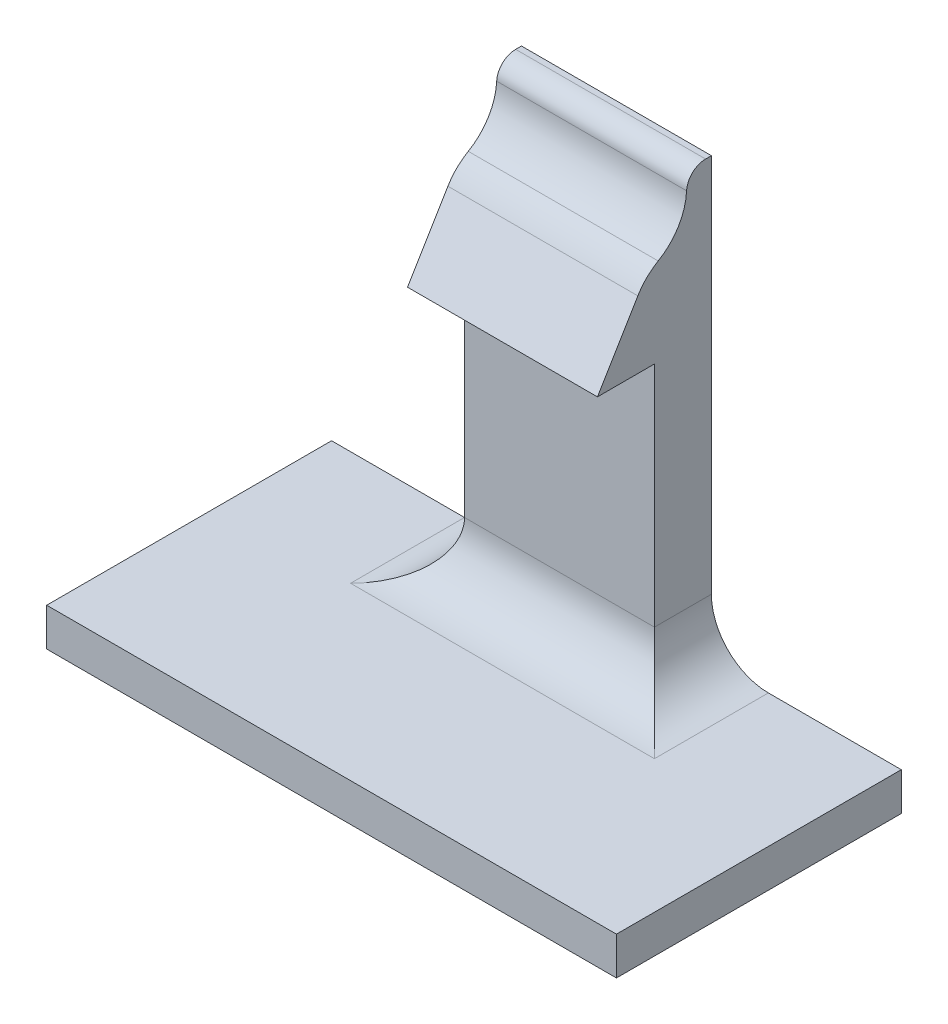
from build123d import *

# Parameters (mm, degrees)
SKETCH_1_W      = 30
SKETCH_1_H      = 15
EXTRUDE_1_DEPTH = 2
SKETCH_2_W      = 10
SKETCH_2_H      = 3
EXTRUDE_2_DEPTH = 20
EXTRUDE_3_DEPTH = 10
FILLET_2_R      = 3
FILLET_3_R      = 3
FILLET_4_R      = 3
SKETCH_5_W      = 10
SKETCH_5_H      = 1.301428863
EXTRUDE_4_DEPTH = 3
FILLET_5_R      = 3
FILLET_6_R      = 1


with BuildPart() as part:
    # Эскиз1 → Бобышка-Вытянуть1 (new body)
    with BuildSketch(Plane(origin=(0, 0, 0), x_dir=(1, 0, 0), z_dir=(0, 1, 0))):
        Rectangle(SKETCH_1_W, SKETCH_1_H)
    extrude(amount=EXTRUDE_1_DEPTH)

    # Эскиз2 → Бобышка-Вытянуть2 (add)
    with BuildSketch(Plane(origin=(0, 2, 0), x_dir=(1, 0, 0), z_dir=(0, 1, 0))):
        with Locations((0, 6)):
            Rectangle(SKETCH_2_W, SKETCH_2_H)
    extrude(amount=EXTRUDE_2_DEPTH)

    # Эскиз3 → Бобышка-Вытянуть3 (add)
    with BuildSketch(Plane.ZY.offset(5)):
        Polygon((-4.5, 22), (-1.5, 17), (-4.5, 17), align=None)
    extrude(amount=-EXTRUDE_3_DEPTH)

    # Скругление2
    fillet_2_edges = [part.edges().sort_by_distance(p)[0] for p in [
        (0, 22, -4.5),
    ]]
    fillet(fillet_2_edges, radius=FILLET_2_R)

    # Скругление3
    fillet_3_edges = [part.edges().sort_by_distance(p)[0] for p in [
        (0, 2, -4.5),
    ]]
    fillet(fillet_3_edges, radius=FILLET_3_R)

    # Скругление4
    fillet_4_edges = [part.edges().sort_by_distance(p)[0] for p in [
        (-5, 2, -4.5),
        (5, 2, -4.5),
    ]]
    fillet(fillet_4_edges, radius=FILLET_4_R)

    # Эскиз5 → Бобышка-Вытянуть4 (add)
    with BuildSketch(Plane(origin=(0, 22, 0), x_dir=(1, 0, 0), z_dir=(0, 1, 0))):
        with Locations((0, 6.849285569)):
            Rectangle(SKETCH_5_W, SKETCH_5_H)
    extrude(amount=EXTRUDE_4_DEPTH)

    # Скругление5
    fillet_5_edges = [part.edges().sort_by_distance(p)[0] for p in [
        (0, 22, -6.198571137),
    ]]
    fillet(fillet_5_edges, radius=FILLET_5_R)

    # Скругление6
    fillet_6_edges = [part.edges().sort_by_distance(p)[0] for p in [
        (0, 25, -6.198571137),
    ]]
    fillet(fillet_6_edges, radius=FILLET_6_R)


solid = part.part
